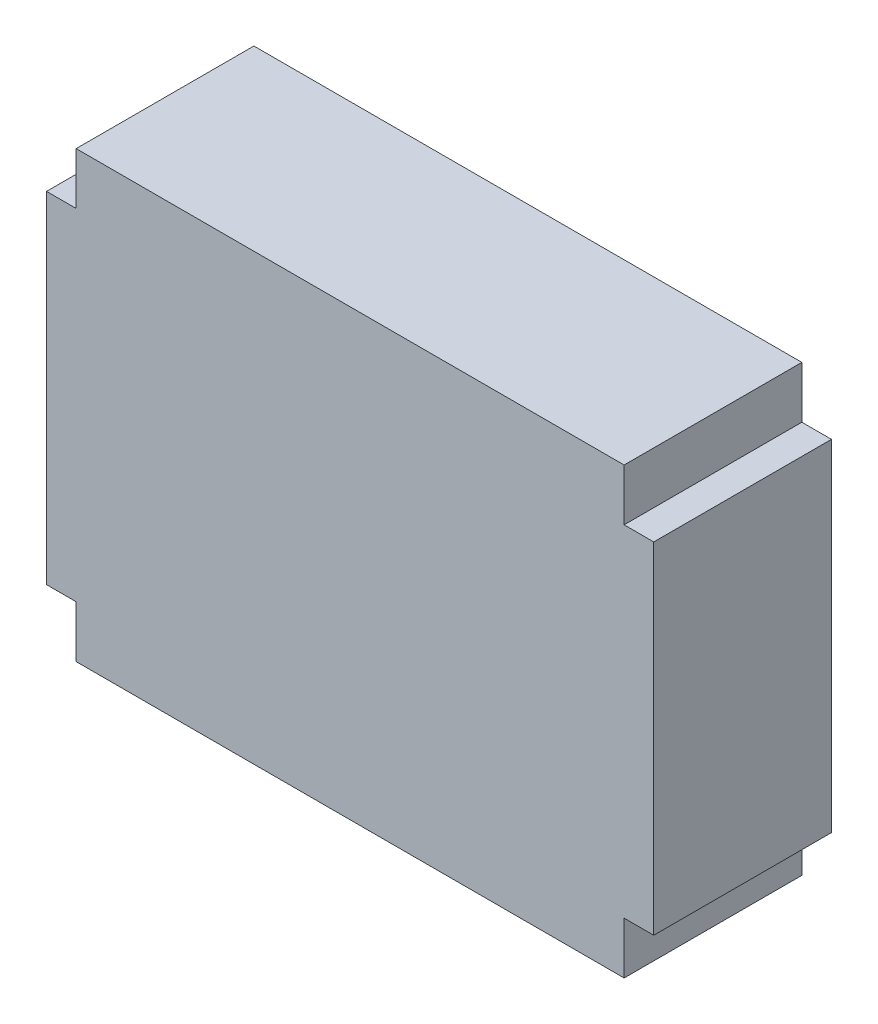
from build123d import *

# Parameters (mm, degrees)
COMPONENT_OUTLINE_DEPTH = 1.2


with BuildPart() as part:
    # 草图1 → Component_Outline (new body)
    with BuildSketch(Plane.XY):
        Polygon((1.85, -1.5), (1.85, -1.15), (2.05, -1.15), (2.05, 1.15), (1.85, 1.15), (1.85, 1.5), (-1.85, 1.5), (-1.85, 1.15), (-2.05, 1.15), (-2.05, -1.15), (-1.85, -1.15), (-1.85, -1.5), align=None)
    extrude(amount=COMPONENT_OUTLINE_DEPTH)


solid = part.part
